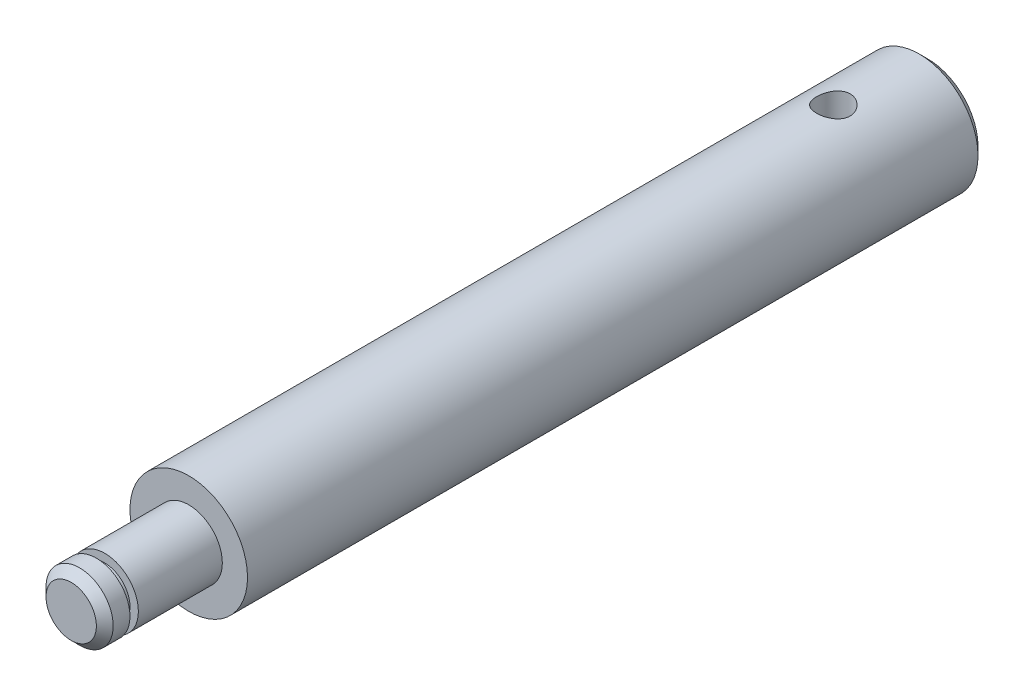
from build123d import *

# Parameters (mm, degrees)
ESQUISSE1_R                   = 3.5
BOSS_EXTRU_1_DEPTH            = 44
ESQUISSE2_R                   = 2
BOSS_EXTRU_2_DEPTH            = 5
ESQUISSE3_R                   = 1.5
BOSS_EXTRU_3_DEPTH            = 0.5
ESQUISSE4_R                   = 2
BOSS_EXTRU_4_DEPTH            = 1.5
CHANFREIN1_SIZE               = 0.5
CHANFREIN2_SIZE               = 0.5
DIAM_TRE_DU_PER_AGE_2_0_2_3_D = 2


with BuildPart() as part:
    # Esquisse1 → Boss.-Extru.1 (new body)
    with BuildSketch(Plane.XY):
        Circle(ESQUISSE1_R)
    extrude(amount=BOSS_EXTRU_1_DEPTH)

    # Esquisse2 → Boss.-Extru.2 (add)
    with BuildSketch(Plane.XY.offset(44)):
        Circle(ESQUISSE2_R)
    extrude(amount=BOSS_EXTRU_2_DEPTH)

    # Esquisse3 → Boss.-Extru.3 (add)
    with BuildSketch(Plane.XY.offset(49)):
        Circle(ESQUISSE3_R)
    extrude(amount=BOSS_EXTRU_3_DEPTH)

    # Esquisse4 → Boss.-Extru.4 (add)
    with BuildSketch(Plane.XY.offset(49.5)):
        Circle(ESQUISSE4_R)
    extrude(amount=BOSS_EXTRU_4_DEPTH)

    # Chanfrein1
    chanfrein1_edges = [part.edges().sort_by_distance(p)[0] for p in [
        (-2, 0, 51),
    ]]
    chamfer(chanfrein1_edges, length=CHANFREIN1_SIZE)

    # Chanfrein2
    chanfrein2_edges = [part.edges().sort_by_distance(p)[0] for p in [
        (-3.5, 0, 0),
    ]]
    chamfer(chanfrein2_edges, length=CHANFREIN2_SIZE)

    # Diamètre du perçage Ø2.0 (2)3 (through all)
    with Locations(Plane(origin=(0, 3.5, 5.615), x_dir=(1, 0, 0), z_dir=(0, 1, 0))):
        with Locations((0, 0)):
            Hole(DIAM_TRE_DU_PER_AGE_2_0_2_3_D / 2)


solid = part.part
